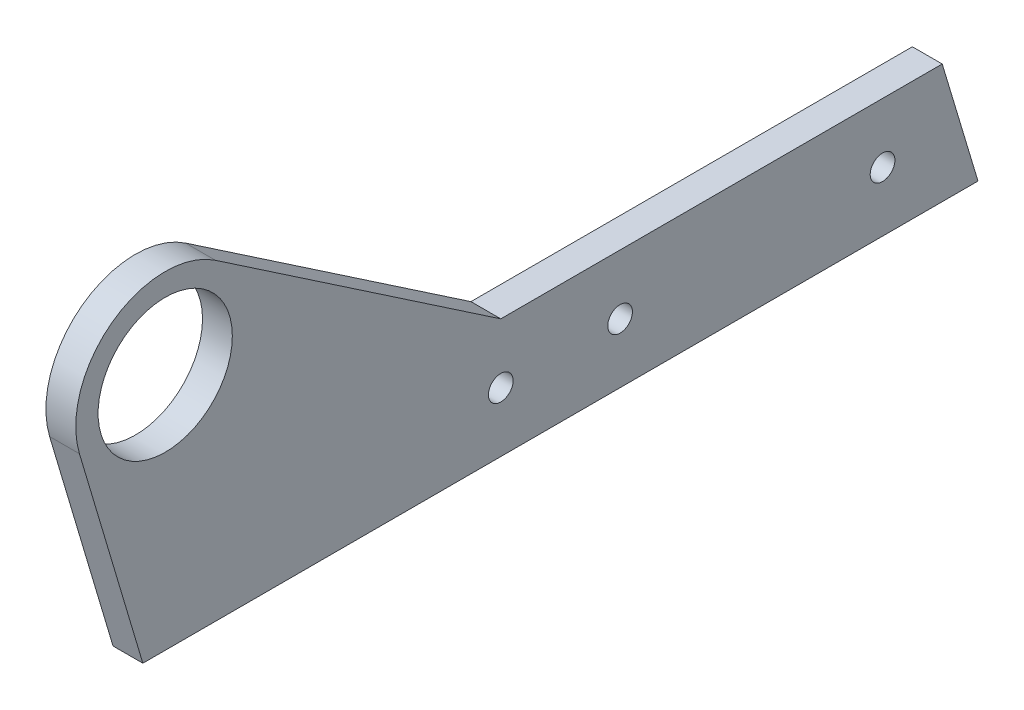
from build123d import *

# Parameters (mm, degrees)
SKETCH1_R           = 14.2875
SKETCH1_R_2         = 2.6289
BOSS_EXTRUDE1_DEPTH = 6.35


with BuildPart() as part:
    # Sketch1 → Boss-Extrude1 (new body)
    with BuildSketch(Plane(origin=(0, 0, 0), x_dir=(0, 0, -1), z_dir=(1, 0, 0))):
        with BuildLine():
            Line((-12.7, -12.7), (-88.9, -12.7))
            Line((-88.9, -12.7), (-102.396644635, 32.66804481))
            ThreePointArc((-102.396644635, 32.66804481), (-95.394210317, 53.468440807), (-73.450431984, 53.869878795))
            Line((-73.450431984, 53.869878795), (-12.7, 12.7))
            Line((-12.7, 12.7), (25.4, 12.7))
            Line((25.4, 12.7), (81.28, 12.7))
            Line((81.28, 12.7), (88.9, -12.7))
            Line((88.9, -12.7), (25.4, -12.7))
            Line((25.4, -12.7), (-12.7, -12.7))
        make_face()
        with Locations((-84.1375, 38.1)):
            Circle(SKETCH1_R, mode=Mode.SUBTRACT)
        with Locations((-12.7, 0)):
            Circle(SKETCH1_R_2, mode=Mode.SUBTRACT)
        with Locations((12.7, 0)):
            Circle(SKETCH1_R_2, mode=Mode.SUBTRACT)
        with Locations((68.58, 0)):
            Circle(SKETCH1_R_2, mode=Mode.SUBTRACT)
    extrude(amount=BOSS_EXTRUDE1_DEPTH)


solid = part.part
